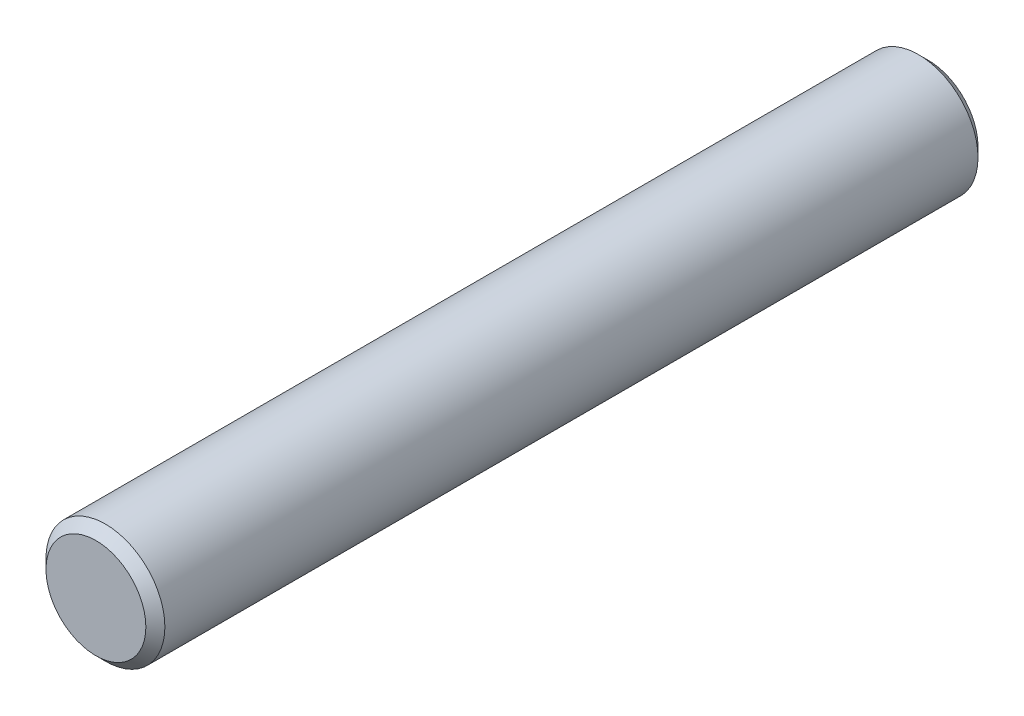
from build123d import *

# Parameters (mm, degrees)
SKETCH1_R           = 1.5875
BOSS_EXTRUDE1_DEPTH = 22.225
CHAMFER1_SIZE       = 0.254


with BuildPart() as part:
    # Sketch1 → Boss-Extrude1 (new body)
    with BuildSketch(Plane.XY):
        Circle(SKETCH1_R)
    extrude(amount=BOSS_EXTRUDE1_DEPTH)

    # Chamfer1
    chamfer1_edges = [part.edges().sort_by_distance(p)[0] for p in [
        (-1.5875, 0, 0),
        (-1.5875, 0, 22.225),
    ]]
    chamfer(chamfer1_edges, length=CHAMFER1_SIZE)


solid = part.part
